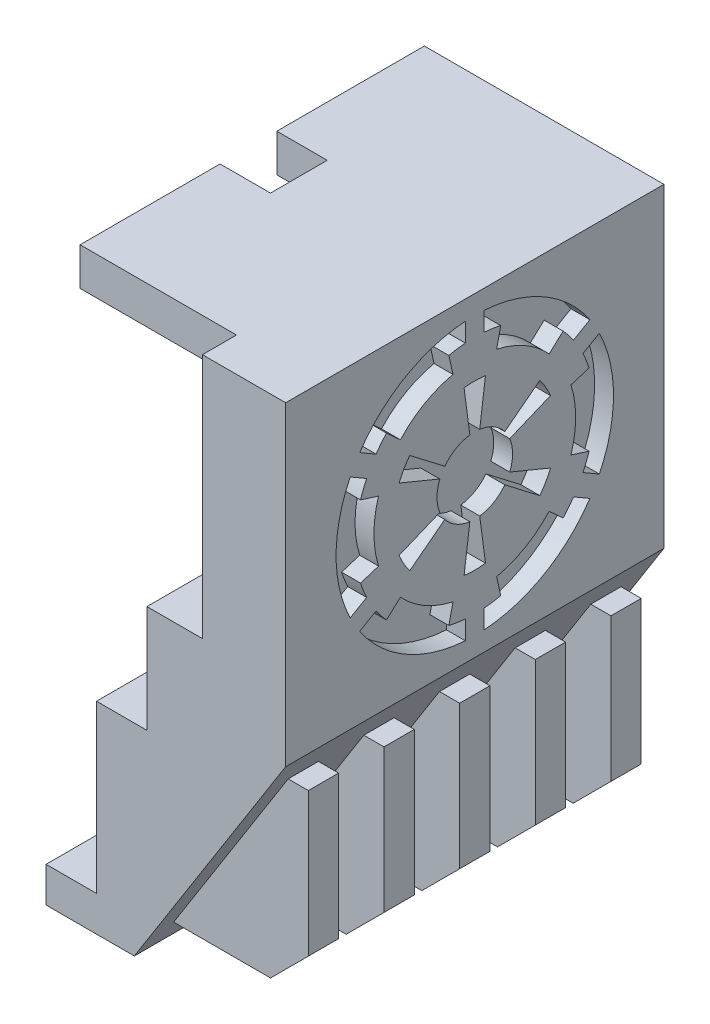
from build123d import *

# Parameters (mm, degrees)
SKETCH1_W            = 30
SKETCH1_H            = 25
BOSS_EXTRUDE1_DEPTH  = 3
SKETCH2_W            = 9
SKETCH2_H            = 3
SKETCH2_W_2          = 14
BOSS_EXTRUDE2_DEPTH  = 16
SKETCH3_W            = 4.3
SKETCH3_H            = 3
BOSS_EXTRUDE3_DEPTH  = 12
SKETCH4_W            = 30
SKETCH4_H            = 5.5
BOSS_EXTRUDE4_DEPTH  = 8
BOSS_EXTRUDE5_DEPTH  = 30
SKETCH7_W            = 4
SKETCH7_H            = 9
SKETCH7_H_2          = 16.7
BOSS_EXTRUDE6_DEPTH  = 3
BOSS_EXTRUDE8_REACH  = 41.727
SKETCH11_W           = 2.4
SKETCH11_H           = 14.373311352
CHAMFER1_SIZE        = 3
SKETCH12_R           = 3
CUT_EXTRUDE1_DEPTH   = 1.5
SKETCH13_W           = 2.7
SKETCH13_H           = 19.5
BOSS_EXTRUDE9_DEPTH  = 3.6
SKETCH15_W           = 12
SKETCH15_H           = 16.5
BOSS_EXTRUDE11_DEPTH = 2
SKETCH16_W           = 16.679178025
SKETCH16_H           = 22.840052547
BOSS_EXTRUDE12_DEPTH = 3
SKETCH17_W           = 12.4
SKETCH17_H           = 2.7
CUT_EXTRUDE2_DEPTH   = 13
SKETCH18_W           = 4
SKETCH18_H           = 4.5
CUT_EXTRUDE4_DEPTH   = 50.162994213
SKETCH19_W           = 4
SKETCH19_H           = 4.3
BOSS_EXTRUDE13_DEPTH = 3
SKETCH20_W           = 4
SKETCH20_H           = 1
CUT_EXTRUDE5_DEPTH   = 13
SKETCH21_W           = 4
SKETCH21_H           = 0.2
CUT_EXTRUDE6_DEPTH   = 47.349217901


with BuildPart() as part:
    # Sketch1 → Boss-Extrude1 (new body)
    with BuildSketch(Plane(origin=(0, 0, 0), x_dir=(0, 0, -1), z_dir=(1, 0, 0))):
        Rectangle(SKETCH1_W, SKETCH1_H)
    extrude(amount=BOSS_EXTRUDE1_DEPTH)

    # Sketch2 → Boss-Extrude2 (add)
    with BuildSketch(Plane.ZY):
        with Locations((10.5, 11)):
            Rectangle(SKETCH2_W, SKETCH2_H)
        with Locations((-5.3, 11)):
            Rectangle(SKETCH2_W_2, SKETCH2_H)
    extrude(amount=BOSS_EXTRUDE2_DEPTH)

    # Sketch3 → Boss-Extrude3 (add)
    with BuildSketch(Plane.ZY):
        with Locations((3.85, 11)):
            Rectangle(SKETCH3_W, SKETCH3_H)
    extrude(amount=BOSS_EXTRUDE3_DEPTH)

    # Sketch4 → Boss-Extrude4 (add)
    with BuildSketch(Plane.ZY):
        with Locations((0, -9.75)):
            Rectangle(SKETCH4_W, SKETCH4_H)
    extrude(amount=BOSS_EXTRUDE4_DEPTH)

    # Sketch5 → Boss-Extrude5 (add)
    with BuildSketch(Plane.XY.offset(15)):
        Polygon((-12, -31.5), (-9, -31.5), (3, -12.5), (-8, -12.5), (-8, -15.5), (-12, -15.5), align=None)
    extrude(amount=-BOSS_EXTRUDE5_DEPTH)

    # Sketch7 → Boss-Extrude6 (add)
    with BuildSketch(Plane.XZ.offset(31.5)):
        with Locations((-14, 10.5)):
            Rectangle(SKETCH7_W, SKETCH7_H)
        with Locations((-14, -6.65)):
            Rectangle(SKETCH7_W, SKETCH7_H_2)
    extrude(amount=-BOSS_EXTRUDE6_DEPTH)

    # Boss-Extrude8: up to this plane
    boss_extrude8_end = Plane(origin=(-9, -31.5, -39.207436874), z_dir=(0.8454889030309711, -0.5339929913879816, 0))
    # Sketch11 → Boss-Extrude8 (add, up to the surface)
    with BuildSketch(Plane(origin=(3, 0, 0), x_dir=(0, 0, -1), z_dir=(1, 0, 0)), mode=Mode.PRIVATE) as boss_extrude8_sk1:
        with Locations((-12, -22.223122385)):
            Rectangle(SKETCH11_W, SKETCH11_H)
    boss_extrude8_tool1 = split(extrude(boss_extrude8_sk1.sketch, amount=-BOSS_EXTRUDE8_REACH, mode=Mode.PRIVATE), bisect_by=boss_extrude8_end, keep=Keep.BOTH, mode=Mode.PRIVATE)
    add(boss_extrude8_tool1.solids().sort_by_distance((3, -22.223122, 12))[0])
    # Sketch11 → Boss-Extrude8 (add, up to the surface)
    with BuildSketch(Plane(origin=(3, 0, 0), x_dir=(0, 0, -1), z_dir=(1, 0, 0)), mode=Mode.PRIVATE) as boss_extrude8_sk2:
        with Locations((-6, -22.223122385)):
            Rectangle(SKETCH11_W, SKETCH11_H)
    boss_extrude8_tool2 = split(extrude(boss_extrude8_sk2.sketch, amount=-BOSS_EXTRUDE8_REACH, mode=Mode.PRIVATE), bisect_by=boss_extrude8_end, keep=Keep.BOTH, mode=Mode.PRIVATE)
    add(boss_extrude8_tool2.solids().sort_by_distance((3, -22.223122, 6))[0])
    # Sketch11 → Boss-Extrude8 (add, up to the surface)
    with BuildSketch(Plane(origin=(3, 0, 0), x_dir=(0, 0, -1), z_dir=(1, 0, 0)), mode=Mode.PRIVATE) as boss_extrude8_sk3:
        with Locations((0, -22.223122385)):
            Rectangle(SKETCH11_W, SKETCH11_H)
    boss_extrude8_tool3 = split(extrude(boss_extrude8_sk3.sketch, amount=-BOSS_EXTRUDE8_REACH, mode=Mode.PRIVATE), bisect_by=boss_extrude8_end, keep=Keep.BOTH, mode=Mode.PRIVATE)
    add(boss_extrude8_tool3.solids().sort_by_distance((3, -22.223122, 0))[0])
    # Sketch11 → Boss-Extrude8 (add, up to the surface)
    with BuildSketch(Plane(origin=(3, 0, 0), x_dir=(0, 0, -1), z_dir=(1, 0, 0)), mode=Mode.PRIVATE) as boss_extrude8_sk4:
        with Locations((6, -22.223122385)):
            Rectangle(SKETCH11_W, SKETCH11_H)
    boss_extrude8_tool4 = split(extrude(boss_extrude8_sk4.sketch, amount=-BOSS_EXTRUDE8_REACH, mode=Mode.PRIVATE), bisect_by=boss_extrude8_end, keep=Keep.BOTH, mode=Mode.PRIVATE)
    add(boss_extrude8_tool4.solids().sort_by_distance((3, -22.223122, -6))[0])
    # Sketch11 → Boss-Extrude8 (add, up to the surface)
    with BuildSketch(Plane(origin=(3, 0, 0), x_dir=(0, 0, -1), z_dir=(1, 0, 0)), mode=Mode.PRIVATE) as boss_extrude8_sk5:
        with Locations((12, -22.223122385)):
            Rectangle(SKETCH11_W, SKETCH11_H)
    boss_extrude8_tool5 = split(extrude(boss_extrude8_sk5.sketch, amount=-BOSS_EXTRUDE8_REACH, mode=Mode.PRIVATE), bisect_by=boss_extrude8_end, keep=Keep.BOTH, mode=Mode.PRIVATE)
    add(boss_extrude8_tool5.solids().sort_by_distance((3, -22.223122, -12))[0])

    # Chamfer1
    chamfer1_edges = [part.edges().sort_by_distance(p)[0] for p in [
        (3, -29.409778061, 12),
        (3, -29.409778061, 6),
        (3, -29.409778061, 0),
        (3, -29.409778061, -6),
        (3, -29.409778061, -12),
    ]]
    chamfer(chamfer1_edges, length=CHAMFER1_SIZE)

    # Sketch12 → Cut-Extrude1 (cut)
    with BuildSketch(Plane(origin=(3, 0, 0), x_dir=(0, 0, -1), z_dir=(1, 0, 0))):
        with BuildLine():
            Line((-0.75, 9.470348462), (-0.75, 10.974402034))
            ThreePointArc((-0.75, 10.974402034), (-5.5, 9.526279442), (-9.129110953, 6.13672007))
            Line((-9.129110953, 6.13672007), (-7.826562351, 5.384693284))
            ThreePointArc((-7.826562351, 5.384693284), (-7.433328979, 5.915709618), (-7.0041347, 6.418106972))
            ThreePointArc((-7.0041347, 6.418106972), (-4.75, 8.227241336), (-2.056176332, 9.274812068))
            ThreePointArc((-2.056176332, 9.274812068), (-1.406490321, 9.39530654), (-0.75, 9.470348462))
        make_face()
        with BuildLine():
            Line((-8.576562351, 4.085655178), (-9.879110953, 4.837681964))
            ThreePointArc((-9.879110953, 4.837681964), (-11, 0), (-9.879110953, -4.837681964))
            Line((-9.879110953, -4.837681964), (-8.576562351, -4.085655178))
            ThreePointArc((-8.576562351, -4.085655178), (-8.8398193, -3.479596922), (-9.060311032, -2.856705095))
            ThreePointArc((-9.060311032, -2.856705095), (-9.5, 0), (-9.060311032, 2.856705095))
            ThreePointArc((-9.060311032, 2.856705095), (-8.8398193, 3.479596922), (-8.576562351, 4.085655178))
        make_face()
        with BuildLine():
            Line((-7.826562351, -5.384693284), (-9.129110953, -6.13672007))
            ThreePointArc((-9.129110953, -6.13672007), (-5.5, -9.526279442), (-0.75, -10.974402034))
            Line((-0.75, -10.974402034), (-0.75, -9.470348462))
            ThreePointArc((-0.75, -9.470348462), (-1.406490321, -9.39530654), (-2.056176332, -9.274812068))
            ThreePointArc((-2.056176332, -9.274812068), (-4.75, -8.227241336), (-7.0041347, -6.418106972))
            ThreePointArc((-7.0041347, -6.418106972), (-7.433328979, -5.915709618), (-7.826562351, -5.384693284))
        make_face()
        with BuildLine():
            ThreePointArc((0.75, -10.974402034), (5.5, -9.526279442), (9.129110953, -6.13672007))
            Line((9.129110953, -6.13672007), (7.826562351, -5.384693284))
            ThreePointArc((7.826562351, -5.384693284), (7.433328979, -5.915709618), (7.0041347, -6.418106972))
            ThreePointArc((7.0041347, -6.418106972), (4.75, -8.227241336), (2.056176332, -9.274812068))
            ThreePointArc((2.056176332, -9.274812068), (1.406490321, -9.39530654), (0.75, -9.470348462))
            Line((0.75, -9.470348462), (0.75, -10.974402034))
        make_face()
        with BuildLine():
            ThreePointArc((11, 0), (10.716114512, 2.482919604), (9.879110953, 4.837681964))
            Line((9.879110953, 4.837681964), (8.576562351, 4.085655178))
            ThreePointArc((8.576562351, 4.085655178), (8.8398193, 3.479596922), (9.060311032, 2.856705095))
            ThreePointArc((9.060311032, 2.856705095), (9.389434349, 1.445172169), (9.5, 0))
            ThreePointArc((9.5, 0), (9.389434349, -1.445172169), (9.060311032, -2.856705095))
            ThreePointArc((9.060311032, -2.856705095), (8.8398193, -3.479596922), (8.576562351, -4.085655178))
            Line((8.576562351, -4.085655178), (9.879110953, -4.837681964))
            ThreePointArc((9.879110953, -4.837681964), (10.716114512, -2.482919604), (11, 0))
        make_face()
        with BuildLine():
            ThreePointArc((9.129110953, 6.13672007), (5.5, 9.526279442), (0.75, 10.974402034))
            Line((0.75, 10.974402034), (0.75, 9.470348462))
            ThreePointArc((0.75, 9.470348462), (1.406490321, 9.39530654), (2.056176332, 9.274812068))
            ThreePointArc((2.056176332, 9.274812068), (4.75, 8.227241336), (7.0041347, 6.418106972))
            ThreePointArc((7.0041347, 6.418106972), (7.433328979, 5.915709618), (7.826562351, 5.384693284))
            Line((7.826562351, 5.384693284), (9.129110953, 6.13672007))
        make_face()
        with BuildLine():
            Line((-1.731516912, 7.810368057), (-2.056176332, 9.274812068))
            ThreePointArc((-2.056176332, 9.274812068), (-4.75, 8.227241336), (-7.0041347, 6.418106972))
            Line((-7.0041347, 6.418106972), (-5.898218694, 5.404721661))
            ThreePointArc((-5.898218694, 5.404721661), (-4, 6.92820323), (-1.731516912, 7.810368057))
        make_face()
        with BuildLine():
            Line((-7.629735606, 2.405646396), (-9.060311032, 2.856705095))
            ThreePointArc((-9.060311032, 2.856705095), (-9.5, 0), (-9.060311032, -2.856705095))
            Line((-9.060311032, -2.856705095), (-7.629735606, -2.405646396))
            ThreePointArc((-7.629735606, -2.405646396), (-8, 0), (-7.629735606, 2.405646396))
        make_face()
        with BuildLine():
            Line((-5.898218694, -5.404721661), (-7.0041347, -6.418106972))
            ThreePointArc((-7.0041347, -6.418106972), (-4.75, -8.227241336), (-2.056176332, -9.274812068))
            Line((-2.056176332, -9.274812068), (-1.731516912, -7.810368057))
            ThreePointArc((-1.731516912, -7.810368057), (-4, -6.92820323), (-5.898218694, -5.404721661))
        make_face()
        with BuildLine():
            ThreePointArc((2.056176332, -9.274812068), (4.75, -8.227241336), (7.0041347, -6.418106972))
            Line((7.0041347, -6.418106972), (5.898218694, -5.404721661))
            ThreePointArc((5.898218694, -5.404721661), (4, -6.92820323), (1.731516912, -7.810368057))
            Line((1.731516912, -7.810368057), (2.056176332, -9.274812068))
        make_face()
        with BuildLine():
            ThreePointArc((9.5, 0), (9.389434349, 1.445172169), (9.060311032, 2.856705095))
            Line((9.060311032, 2.856705095), (7.629735606, 2.405646396))
            ThreePointArc((7.629735606, 2.405646396), (7.906892084, 1.21698709), (8, 0))
            ThreePointArc((8, 0), (7.906892084, -1.21698709), (7.629735606, -2.405646396))
            Line((7.629735606, -2.405646396), (9.060311032, -2.856705095))
            ThreePointArc((9.060311032, -2.856705095), (9.389434349, -1.445172169), (9.5, 0))
        make_face()
        with BuildLine():
            ThreePointArc((7.0041347, 6.418106972), (4.75, 8.227241336), (2.056176332, 9.274812068))
            Line((2.056176332, 9.274812068), (1.731516912, 7.810368057))
            ThreePointArc((1.731516912, 7.810368057), (4, 6.92820323), (5.898218694, 5.404721661))
            Line((5.898218694, 5.404721661), (7.0041347, 6.418106972))
        make_face()
        with BuildLine():
            Line((-2.380060021, 1.826284287), (-5.156796712, 3.956949289))
            ThreePointArc((-5.156796712, 3.956949289), (-5.629165125, 3.25), (-6.005216961, 2.48744231))
            Line((-6.005216961, 2.48744231), (-2.771638598, 1.148050297))
            ThreePointArc((-2.771638598, 1.148050297), (-2.598076211, 1.5), (-2.380060021, 1.826284287))
        make_face()
        with BuildLine():
            Line((-2.771638598, -1.148050297), (-6.005216961, -2.48744231))
            ThreePointArc((-6.005216961, -2.48744231), (-5.629165125, -3.25), (-5.156796712, -3.956949289))
            Line((-5.156796712, -3.956949289), (-2.380060021, -1.826284287))
            ThreePointArc((-2.380060021, -1.826284287), (-2.598076211, -1.5), (-2.771638598, -1.148050297))
        make_face()
        with BuildLine():
            Line((-0.391578577, -2.974334584), (-0.848420249, -6.444391599))
            ThreePointArc((-0.848420249, -6.444391599), (0, -6.5), (0.848420249, -6.444391599))
            Line((0.848420249, -6.444391599), (0.391578577, -2.974334584))
            ThreePointArc((0.391578577, -2.974334584), (0, -3), (-0.391578577, -2.974334584))
        make_face()
        with BuildLine():
            ThreePointArc((5.156796712, -3.956949289), (5.629165125, -3.25), (6.005216961, -2.48744231))
            Line((6.005216961, -2.48744231), (2.771638598, -1.148050297))
            ThreePointArc((2.771638598, -1.148050297), (2.598076211, -1.5), (2.380060021, -1.826284287))
            Line((2.380060021, -1.826284287), (5.156796712, -3.956949289))
        make_face()
        with BuildLine():
            ThreePointArc((6.005216961, 2.48744231), (5.629165125, 3.25), (5.156796712, 3.956949289))
            Line((5.156796712, 3.956949289), (2.380060021, 1.826284287))
            ThreePointArc((2.380060021, 1.826284287), (2.598076211, 1.5), (2.771638598, 1.148050297))
            Line((2.771638598, 1.148050297), (6.005216961, 2.48744231))
        make_face()
        with BuildLine():
            ThreePointArc((0.848420249, 6.444391599), (0, 6.5), (-0.848420249, 6.444391599))
            Line((-0.848420249, 6.444391599), (-0.391578577, 2.974334584))
            ThreePointArc((-0.391578577, 2.974334584), (0, 3), (0.391578577, 2.974334584))
            Line((0.391578577, 2.974334584), (0.848420249, 6.444391599))
        make_face()
        Circle(SKETCH12_R)
    extrude(amount=-CUT_EXTRUDE1_DEPTH, mode=Mode.SUBTRACT)

    # Sketch13 → Boss-Extrude9 (add)
    with BuildSketch(Plane.ZY):
        with Locations((13.65, 2.75)):
            Rectangle(SKETCH13_W, SKETCH13_H)
    extrude(amount=BOSS_EXTRUDE9_DEPTH)

    # Sketch15 → Boss-Extrude11 (add)
    with BuildSketch(Plane(origin=(0, 0, -15), x_dir=(-1, 0, 0), z_dir=(0, 0, -1))):
        with Locations((6, 1.25)):
            Rectangle(SKETCH15_W, SKETCH15_H)
    extrude(amount=-BOSS_EXTRUDE11_DEPTH)

    # Sketch16 → Boss-Extrude12 (add)
    with BuildSketch(Plane(origin=(0, 12.5, 0), x_dir=(1, 0, 0), z_dir=(0, 1, 0))):
        with Locations((-7.660410987, 3.579973727)):
            Rectangle(SKETCH16_W, SKETCH16_H)
    extrude(amount=-BOSS_EXTRUDE12_DEPTH)

    # Sketch17 → Cut-Extrude2 (cut)
    with BuildSketch(Plane.XZ.offset(-9.5)):
        with Locations((-9.8, 13.65)):
            Rectangle(SKETCH17_W, SKETCH17_H)
    extrude(amount=-CUT_EXTRUDE2_DEPTH, mode=Mode.SUBTRACT)

    # Sketch18 → Cut-Extrude4 (cut, through all)
    with BuildSketch(Plane(origin=(0, 12.5, 0), x_dir=(1, 0, 0), z_dir=(0, 1, 0))):
        with Locations((-14, 1.05)):
            Rectangle(SKETCH18_W, SKETCH18_H)
    extrude(amount=-CUT_EXTRUDE4_DEPTH, mode=Mode.SUBTRACT)

    # Sketch19 → Boss-Extrude13 (add)
    with BuildSketch(Plane.XZ.offset(31.5)):
        with Locations((-14, 3.85)):
            Rectangle(SKETCH19_W, SKETCH19_H)
    extrude(amount=-BOSS_EXTRUDE13_DEPTH)

    # Sketch20 → Cut-Extrude5 (cut)
    with BuildSketch(Plane(origin=(0, 0, -15), x_dir=(-1, 0, 0), z_dir=(0, 0, -1))):
        with Locations((10, -6.5)):
            Rectangle(SKETCH20_W, SKETCH20_H)
    extrude(amount=-CUT_EXTRUDE5_DEPTH, mode=Mode.SUBTRACT)

    # Sketch21 → Cut-Extrude6 (cut, through all)
    with BuildSketch(Plane(origin=(0, 0, -15), x_dir=(-1, 0, 0), z_dir=(0, 0, -1))):
        with Locations((14, -28.6)):
            Rectangle(SKETCH21_W, SKETCH21_H)
    extrude(amount=-CUT_EXTRUDE6_DEPTH, mode=Mode.SUBTRACT)


solid = part.part
